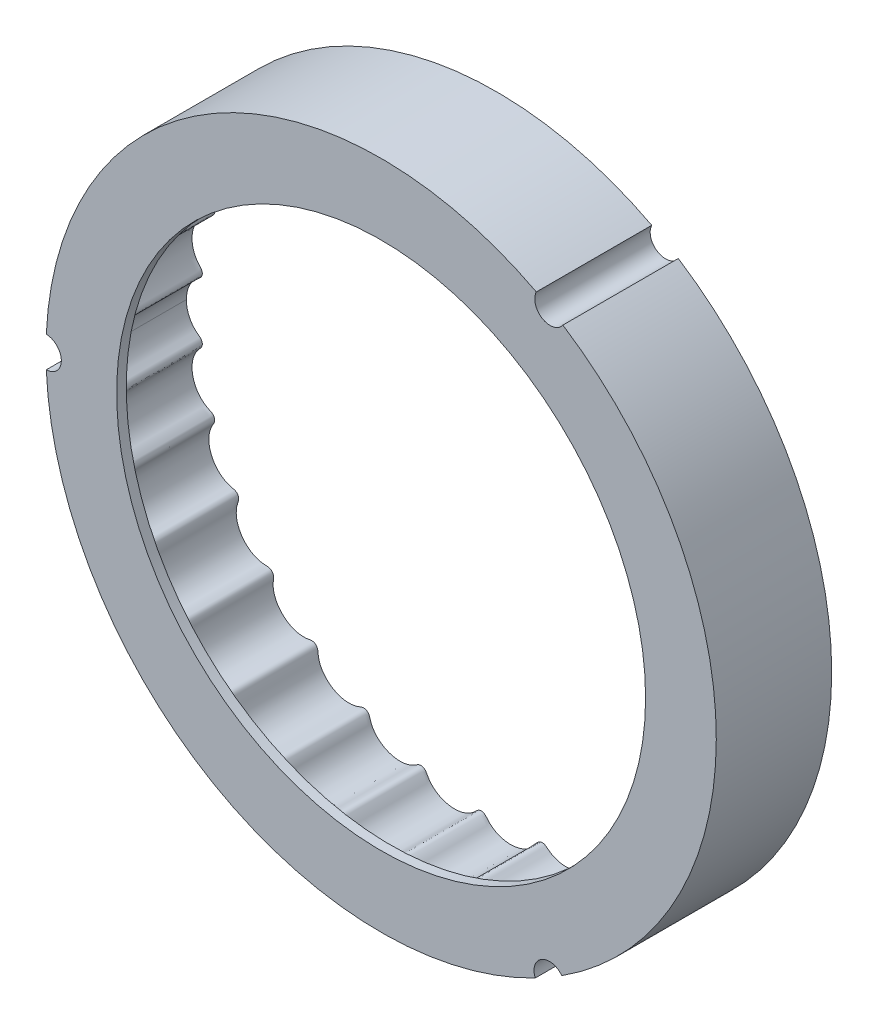
from build123d import *

# Parameters (mm, degrees)
ESQUISSE1_R             = 34.85
BOSS_EXTRU_1_DEPTH      = 11
ESQUISSE3_R             = 34.85
ESQUISSE3_R_2           = 27.5
BOSS_EXTRU_2_DEPTH      = 1
ESQUISSE4_R             = 1.6
ENL_V_MAT_EXTRU_2_DEPTH = 51.725191141


with BuildPart() as part:
    # Esquisse1 → Boss.-Extru.1 (new body)
    with BuildSketch(Plane.XY):
        Circle(ESQUISSE1_R)
        with BuildLine():
            add(Edge.make_bspline(
                [(30.75, 0), (30.75, -0.012466551), (30.750978291, -0.037435326), (30.755380523, -0.087337177), (30.767021407, -0.146605526), (30.784235638, -0.201639987), (30.806725403, -0.255918868), (30.840935147, -0.321123985), (30.887422434, -0.389111538), (30.947096406, -0.458089435), (31.018450958, -0.527969594), (31.087642774, -0.591592772), (31.173963904, -0.671262461), (31.275013947, -0.769628319), (31.418667793, -0.925049962), (31.590505656, -1.149287713), (31.765198528, -1.440584759), (31.922692534, -1.804453032), (32.034958648, -2.194853386), (32.098455422, -2.605847675), (32.110893976, -3.018484836), (32.074041221, -3.426596924), (31.989674774, -3.824502644), (31.859579575, -4.20675551), (31.685835108, -4.56634961), (31.470950798, -4.897742168), (31.24907067, -5.158368371), (31.037624658, -5.355859269), (30.846956876, -5.502834102), (30.686542549, -5.609708869), (30.511303765, -5.713032229), (30.327949226, -5.826454032), (30.173095555, -5.998578141), (30.093232003, -6.229100949), (30.110193836, -6.460044438), (30.200515583, -6.65648558), (30.319195295, -6.81880241), (30.429591873, -6.972377134), (30.556884573, -7.171669121), (30.686990471, -7.42432627), (30.81051827, -7.752064551), (30.902306801, -8.157965927), (30.939306602, -8.590969655), (30.91541063, -9.043225199), (30.833120238, -9.47917927), (30.698564824, -9.892214886), (30.517499761, -10.276882491), (30.295359778, -10.628695383), (30.03663758, -10.942013482), (29.746966061, -11.212937701), (29.470433337, -11.410145285), (29.223317503, -11.547196269), (29.007991406, -11.641437129), (28.831489277, -11.706780195), (28.642058234, -11.769172318), (28.450045732, -11.863081746), (28.288329456, -12.026987259), (28.210287752, -12.224918325), (28.20346133, -12.405406571), (28.236785614, -12.570096872), (28.293783104, -12.715821968), (28.367996779, -12.873214243), (28.441734352, -13.051374202), (28.519282743, -13.279422724), (28.585875989, -13.561168059), (28.625891413, -13.901400281), (28.620176022, -14.296757725), (28.564173119, -14.692691042), (28.458894502, -15.083143097), (28.307859188, -15.458096406), (28.113801834, -15.812569773), (27.879487833, -16.141681779), (27.607733235, -16.440542983), (27.304935504, -16.701120752), (26.975605605, -16.919348027), (26.668066278, -17.069716959), (26.395293942, -17.166332894), (26.161761798, -17.224796282), (25.972001086, -17.258905238), (25.77009755, -17.283912083), (25.556930978, -17.318589654), (25.348986278, -17.421268885), (25.189696924, -17.606062532), (25.120163479, -17.826984077), (25.130694209, -18.042573767), (25.176826858, -18.238110843), (25.216893076, -18.422953837), (25.254028667, -18.656404758), (25.272254044, -18.939939771), (25.254622928, -19.289611344), (25.176827173, -19.698288661), (25.038154347, -20.109986708), (24.836067152, -20.515105141), (24.583785661, -20.886782695), (24.287592504, -21.219855725), (23.953496641, -21.509650647), (23.587386146, -21.751686499), (23.210135668, -21.933657843), (22.873869304, -22.043643078), (22.591374487, -22.102148479), (22.325158766, -22.133594977), (22.101571409, -22.140706228), (21.878531137, -22.127472643), (21.64366765, -22.109610546), (21.438911553, -22.128790646), (21.235010271, -22.221372978), (21.072081402, -22.396691751), (20.993021331, -22.612875938), (20.985637564, -22.829397015), (20.992657275, -23.032781427), (20.989114789, -23.225634535), (20.969103016, -23.465571964), (20.917534051, -23.750425404), (20.818402107, -24.078217858), (20.655461136, -24.438354859), (20.446318236, -24.77898339), (20.131259913, -25.173976814), (19.681623457, -25.583288583), (19.159101878, -25.898679173), (18.590417327, -26.101603516), (18.101715984, -26.187940575), (17.759635951, -26.202985797), (17.470900281, -26.182588302), (17.23345446, -26.142771473), (17.045752759, -26.098427136), (16.850546694, -26.04105894), (16.639855437, -25.991807329), (16.410596194, -26.010096582), (16.197941083, -26.119984154), (16.054054554, -26.291655725), (15.981224755, -26.484264107), (15.946773384, -26.67216042), (15.913564985, -26.847713157), (15.871685839, -27.021430326), (15.818449071, -27.192101981), (15.738226672, -27.400602374), (15.563680399, -27.758482427), (15.294509879, -28.138551919), (14.917145191, -28.511493641), (14.463348217, -28.825916643), (14.067254883, -29.030313323), (13.644707988, -29.182609996), (13.202266996, -29.278018794), (12.769160471, -29.310447345), (12.354022164, -29.284747019), (12.010913039, -29.215435201), (11.740678008, -29.127800828), (11.523693584, -29.034133165), (11.354530851, -28.949519002), (11.177174481, -28.855377593), (10.972347739, -28.788140756), (10.740900032, -28.795902093), (10.520165877, -28.899715369), (10.365449548, -29.072753766), (10.276488974, -29.269813162), (10.202138665, -29.459209799), (10.122065567, -29.634640688), (10.007780433, -29.846547273), (9.846740686, -30.087038042), (9.624994499, -30.347917925), (9.257073915, -30.680872369), (8.748044271, -31.005547481), (8.178506642, -31.224841958), (7.579451288, -31.328982908), (7.074194818, -31.33558044), (6.676837151, -31.291826712), (6.292424803, -31.199581901), (5.972732278, -31.076737502), (5.716146602, -30.942666011), (5.514413234, -30.811214119), (5.359908708, -30.695731217), (5.203466143, -30.565531259), (5.026930794, -30.439720932), (4.806886962, -30.371834664), (4.568763859, -30.395570685), (4.371718028, -30.501884115), (4.232419886, -30.652981867), (4.127613713, -30.812483406), (4.027239219, -30.960328748), (3.919539933, -31.102873512), (3.802517078, -31.238030468), (3.645681729, -31.39708508), (3.342807108, -31.655393467), (2.850196764, -31.953463879), (2.236864317, -32.159554757), (1.57334615, -32.232200172), (1.015521856, -32.196526691), (0.571557429, -32.107674615), (0.161283705, -31.964658139), (-0.209217883, -31.775370602), (-0.496194196, -31.574729658), (-0.708889751, -31.386328198), (-0.870479972, -31.213757884), (-0.991906569, -31.068751011), (-1.118600595, -30.912755833), (-1.283802812, -30.77364241), (-1.50177773, -30.695368016), (-1.745288935, -30.710453884), (-1.952773559, -30.813794282), (-2.109935037, -30.9617471), (-2.253484059, -31.105903729), (-2.396791197, -31.234857562), (-2.586266177, -31.383358797), (-2.829905081, -31.53946165), (-3.137313102, -31.690050518), (-3.511638872, -31.816266932), (-3.903126981, -31.89558302), (-4.305796572, -31.92693373), (-4.709428249, -31.91017939), (-5.108431436, -31.846078498), (-5.497253612, -31.735420208), (-5.870273183, -31.579083817), (-6.217378252, -31.380436639), (-6.533152655, -31.142394658), (-6.777297144, -30.902023384), (-6.958914424, -30.676536915), (-7.091402356, -30.4753478), (-7.186885131, -30.30782225), (-7.265867953, -30.152740478), (-7.346855679, -30.018784595), (-7.457681197, -29.892404345), (-7.60553599, -29.788631328), (-7.810335103, -29.731112085), (-8.038593116, -29.760689184), (-8.229618994, -29.856257723), (-8.394816518, -29.9678965), (-8.554688939, -30.067243562), (-8.761219567, -30.179444188), (-9.021074936, -30.290468637), (-9.346448338, -30.387833531), (-9.738074935, -30.45039329), (-10.144176955, -30.462548242), (-10.558233153, -30.422238345), (-10.973080432, -30.329358), (-11.381841314, -30.182346239), (-11.776677722, -29.979979329), (-12.148584824, -29.721454636), (-12.467916496, -29.426609232), (-12.732187808, -29.105081948), (-12.915225976, -28.80641542), (-13.03487844, -28.548612507), (-13.114181552, -28.325794213), (-13.167788721, -28.144409516), (-13.22395419, -27.951277061), (-13.325570796, -27.760308071), (-13.499181016, -27.607119994), (-13.731038092, -27.531281103), (-13.961638649, -27.550325469), (-14.163155902, -27.626619217), (-14.352236725, -27.701671193), (-14.535020621, -27.762827079), (-14.768085048, -27.823174098), (-15.053755399, -27.868974691), (-15.395692291, -27.884288313), (-15.789188843, -27.850723971), (-16.278477536, -27.746331558), (-16.752840182, -27.560901205), (-17.194557572, -27.301468319), (-17.590716934, -26.97428386), (-17.87644948, -26.672015571), (-18.115919757, -26.343859054), (-18.306739131, -25.996227401), (-18.429482089, -25.679570016), (-18.501270208, -25.406255491), (-18.539399373, -25.174330622), (-18.558976893, -24.987108047), (-18.571760551, -24.78819228), (-18.61171465, -24.578519008), (-18.726239883, -24.378949606), (-18.895897533, -24.250627404), (-19.068047978, -24.195684752), (-19.235848336, -24.184165155), (-19.391500857, -24.201416651), (-19.562492555, -24.233940762), (-19.753354572, -24.26127601), (-19.993502931, -24.280111301), (-20.282978203, -24.275062722), (-20.62258955, -24.229742144), (-21.00431105, -24.126378447), (-21.374143581, -23.974062339), (-21.726452872, -23.775287984), (-22.052339004, -23.536012023), (-22.347665728, -23.260153139), (-22.608419903, -22.951625966), (-22.830585063, -22.614392221), (-23.008044532, -22.256577927), (-23.137966714, -21.883559883), (-23.207650802, -21.548434104), (-23.233868929, -21.260282098), (-23.232901154, -21.019548449), (-23.218935644, -20.827285344), (-23.19308791, -20.625499772), (-23.171395968, -20.410869823), (-23.21469466, -20.183284139), (-23.349964976, -19.980242783), (-23.544142607, -19.854031001), (-23.755029658, -19.806888177), (-23.955988469, -19.801799201), (-24.144986012, -19.794823888), (-24.380442174, -19.773074374), (-24.659723113, -19.720773466), (-25.102454644, -19.583748012), (-25.571923788, -19.333855047), (-26.003256706, -18.993006763), (-26.375870189, -18.571626824), (-26.625124857, -18.20215167), (-26.823075066, -17.806717527), (-26.966843844, -17.392192767), (-27.049756553, -16.981734052), (-27.073164572, -16.628783839), (-27.060044319, -16.340630955), (-27.030669176, -16.119187804), (-26.995774458, -15.943853854), (-26.949270457, -15.771357955), (-26.894033787, -15.601397958), (-26.831811628, -15.421030995), (-26.796169531, -15.21878135), (-26.830728435, -14.997622482), (-26.955806551, -14.793653857), (-27.143052722, -14.65948272), (-27.350369916, -14.595684207), (-27.549151744, -14.551819123), (-27.735133332, -14.500607364), (-27.96273584, -14.421993188), (-28.226061235, -14.301645035), (-28.519239284, -14.12455143), (-28.827934712, -13.877519508), (-29.106252012, -13.590487417), (-29.410945114, -13.187328958), (-29.648569421, -12.739752245), (-29.813457, -12.260672538), (-29.900219677, -11.763100346), (-29.920303758, -11.36407803), (-29.890631705, -10.970079215), (-29.820680989, -10.634943946), (-29.729600376, -10.360248477), (-29.632436108, -10.139979755), (-29.542989628, -9.969160834), (-29.438948985, -9.794318673), (-29.336710564, -9.603945127), (-29.292590558, -9.376156501), (-29.34341498, -9.137555324), (-29.477260018, -8.948550251), (-29.655010404, -8.826328968), (-29.837952398, -8.743428067), (-30.00852719, -8.661710233), (-30.215640088, -8.547820996), (-30.450678595, -8.388222873), (-30.715953105, -8.159786654), (-30.990944518, -7.847674225), (-31.231016889, -7.485674209), (-31.427032099, -7.077644595), (-31.565885953, -6.650463689), (-31.647333706, -6.212241917), (-31.671341992, -5.770595707), (-31.637967099, -5.332917719), (-31.550269505, -4.923309446), (-31.430833245, -4.590237023), (-31.303681047, -4.331264436), (-31.188262944, -4.139982886), (-31.086186829, -3.993222979), (-30.974688463, -3.853591969), (-30.856371815, -3.719709273), (-30.728634747, -3.577746879), (-30.619668631, -3.403178608), (-30.570027677, -3.184776013), (-30.611119827, -2.948973779), (-30.735347564, -2.755298657), (-30.902668511, -2.617892737), (-31.067663107, -2.498810148), (-31.217809804, -2.377731949), (-31.394966629, -2.21470965), (-31.588243327, -1.999182568), (-31.757029051, -1.761099309), (-31.899946191, -1.50432232), (-32.001745872, -1.278667082), (-32.072893478, -1.089795434), (-32.132225215, -0.897200595), (-32.179715684, -0.70082959), (-32.210893403, -0.527619645), (-32.230197764, -0.377050267), (-32.241336158, -0.25116251), (-32.247277005, -0.157631371), (-32.24950491, -0.064498225), (-32.25, -0.021409221), (-32.25, 0)],
                knots=[0.074164953, 0.074164953, 0.074164953, 0.074164953, 0.074164953, 0.07460362, 0.075042288, 0.075480956, 0.075919624, 0.076358291, 0.076796959, 0.077674294, 0.078376767, 0.07907924, 0.079781713, 0.080484186, 0.081889131, 0.083294077, 0.086103968, 0.088913859, 0.092014101, 0.095114343, 0.098214585, 0.101314828, 0.10432547, 0.107336113, 0.110346755, 0.113357398, 0.116234596, 0.119111795, 0.120550394, 0.121988994, 0.123427593, 0.124866193, 0.126640249, 0.128414306, 0.130187266, 0.131960225, 0.133373318, 0.13478641, 0.136199503, 0.137612595, 0.14043878, 0.143264965, 0.146639475, 0.150013985, 0.153388495, 0.156763005, 0.159864606, 0.162966207, 0.166067808, 0.169169409, 0.171979199, 0.17478899, 0.176193886, 0.177598781, 0.179003676, 0.180408572, 0.182166529, 0.183924486, 0.185705816, 0.186596481, 0.187487146, 0.188926547, 0.190365948, 0.191805349, 0.19324475, 0.196123553, 0.199002355, 0.202017429, 0.205032504, 0.208047579, 0.211062653, 0.214074396, 0.217086139, 0.220097882, 0.223109625, 0.225987087, 0.228864548, 0.230303278, 0.231742009, 0.23318074, 0.23461947, 0.23639559, 0.238171709, 0.239943897, 0.241716085, 0.243128759, 0.244541432, 0.245954105, 0.247366778, 0.250192125, 0.253017472, 0.256390807, 0.259764143, 0.263137479, 0.266510814, 0.269781576, 0.273052337, 0.276323099, 0.27959386, 0.282263597, 0.283598466, 0.284933335, 0.287603072, 0.288937941, 0.290272809, 0.291978349, 0.293683888, 0.295463294, 0.297242701, 0.298681812, 0.300120924, 0.301560035, 0.302999146, 0.305877369, 0.308755592, 0.311769369, 0.314783146, 0.317796922, 0.323823638, 0.329849516, 0.332862455, 0.335740475, 0.338618495, 0.340057505, 0.341496515, 0.342935526, 0.344374536, 0.346152362, 0.347930189, 0.349637201, 0.351344213, 0.352679183, 0.354014153, 0.355349122, 0.356684092, 0.358019062, 0.359354032, 0.362023971, 0.368567294, 0.371838956, 0.375110618, 0.378483109, 0.3818556, 0.385228091, 0.388600583, 0.391425519, 0.394250455, 0.395662923, 0.397075391, 0.398487859, 0.399900327, 0.401671575, 0.403442823, 0.40522, 0.406997176, 0.408436108, 0.409875039, 0.411313971, 0.412752903, 0.415630766, 0.418508629, 0.42152116, 0.427546223, 0.433572959, 0.436587163, 0.439601368, 0.442615573, 0.445493951, 0.44837233, 0.449811519, 0.451250708, 0.452689897, 0.454129086, 0.455909198, 0.457689309, 0.459393993, 0.461098678, 0.462433521, 0.463768363, 0.465103206, 0.466438049, 0.467772891, 0.469107734, 0.471777419, 0.47831802, 0.484858622, 0.488232362, 0.491606102, 0.494979843, 0.498353583, 0.50117918, 0.504004778, 0.505417576, 0.506830375, 0.508243174, 0.509655973, 0.511428503, 0.513201034, 0.514976523, 0.516752012, 0.518190677, 0.519629342, 0.521068008, 0.522506673, 0.525384003, 0.528261333, 0.531272698, 0.534284062, 0.537295427, 0.540306791, 0.543322305, 0.546337819, 0.549353334, 0.552368848, 0.555247889, 0.55812693, 0.559566451, 0.561005971, 0.562445492, 0.563885012, 0.564775961, 0.56566691, 0.567448808, 0.569205741, 0.570962674, 0.572367569, 0.573772465, 0.57517736, 0.576582255, 0.579392045, 0.582201836, 0.585302986, 0.588404136, 0.591505286, 0.594606436, 0.597981309, 0.601356181, 0.604731054, 0.608105927, 0.610932446, 0.613758965, 0.615172225, 0.616585485, 0.617998745, 0.619412004, 0.621185051, 0.622958098, 0.624731365, 0.626504633, 0.627943229, 0.629381826, 0.630820423, 0.63225902, 0.635136214, 0.638013408, 0.641023709, 0.64403401, 0.650054612, 0.653155309, 0.656256005, 0.659356702, 0.662457399, 0.665267223, 0.668077047, 0.669481959, 0.670886871, 0.672291783, 0.673696695, 0.675452531, 0.677208368, 0.678991564, 0.679883162, 0.68077476, 0.682214218, 0.683653677, 0.685093136, 0.686532595, 0.689411513, 0.69229043, 0.695306386, 0.698322342, 0.701338298, 0.704354253, 0.707365251, 0.710376248, 0.713387245, 0.716398242, 0.719275486, 0.722152729, 0.723591351, 0.725029973, 0.726468595, 0.727907217, 0.729682016, 0.731456816, 0.733229603, 0.735002391, 0.736415329, 0.737828268, 0.739241207, 0.740654145, 0.743480023, 0.7463059, 0.753054164, 0.756428296, 0.759802428, 0.763072262, 0.766342096, 0.76961193, 0.772881764, 0.77555143, 0.776886264, 0.778221097, 0.779555931, 0.780890764, 0.782225598, 0.783560431, 0.785264184, 0.786967936, 0.78874869, 0.790529443, 0.791968729, 0.793408015, 0.7948473, 0.796286586, 0.799165157, 0.802043728, 0.805058366, 0.808073004, 0.811087641, 0.817114411, 0.820126544, 0.823138676, 0.826150808, 0.829028446, 0.831906085, 0.833344904, 0.834783723, 0.836222542, 0.837661361, 0.839438045, 0.841214729, 0.842986489, 0.84475825, 0.846170813, 0.847583376, 0.848995939, 0.850408501, 0.853233627, 0.856058753, 0.859431672, 0.862804591, 0.86617751, 0.869550429, 0.872821645, 0.87609286, 0.879364076, 0.882635291, 0.885305113, 0.886640024, 0.887974936, 0.889309847, 0.890644758, 0.891979669, 0.89331458, 0.895020895, 0.896727211, 0.898505854, 0.900284498, 0.901723549, 0.903162601, 0.904601653, 0.906040705, 0.908918809, 0.911796913, 0.91330359, 0.914810268, 0.916316945, 0.917823622, 0.919330299, 0.920836976, 0.921590315, 0.922343654, 0.923096992, 0.923850331, 0.923850331, 0.923850331, 0.923850331, 0.923850331], degree=4))
            add(Edge.make_bspline(
                [(30.75, 0), (30.75, 0.012466551), (30.750978291, 0.037435326), (30.755380523, 0.087337177), (30.767021407, 0.146605526), (30.784235638, 0.201639987), (30.806725403, 0.255918868), (30.840935147, 0.321123985), (30.887422434, 0.389111538), (30.947096406, 0.458089435), (31.018450958, 0.527969594), (31.087642774, 0.591592772), (31.173963904, 0.671262461), (31.275013947, 0.769628319), (31.418667793, 0.925049962), (31.590505656, 1.149287713), (31.765198528, 1.440584759), (31.922692534, 1.804453032), (32.034958648, 2.194853386), (32.098455422, 2.605847675), (32.110893976, 3.018484836), (32.074041221, 3.426596924), (31.989674774, 3.824502644), (31.859579575, 4.20675551), (31.685835108, 4.566349611), (31.470950798, 4.897742168), (31.24907067, 5.158368371), (31.037624658, 5.355859269), (30.846956876, 5.502834102), (30.686542549, 5.609708869), (30.511303765, 5.713032229), (30.327949226, 5.826454032), (30.173095555, 5.998578141), (30.093232003, 6.229100949), (30.110193836, 6.460044438), (30.200515583, 6.65648558), (30.319195295, 6.81880241), (30.429591873, 6.972377134), (30.556884573, 7.171669121), (30.686990471, 7.42432627), (30.81051827, 7.752064551), (30.902306801, 8.157965927), (30.939306602, 8.590969655), (30.91541063, 9.043225199), (30.833120238, 9.47917927), (30.698564824, 9.892214886), (30.517499761, 10.276882491), (30.295359778, 10.628695384), (30.03663758, 10.942013482), (29.746966061, 11.212937701), (29.470433337, 11.410145285), (29.223317503, 11.547196269), (29.007991406, 11.641437129), (28.831489277, 11.706780195), (28.642058234, 11.769172318), (28.450045732, 11.863081747), (28.288329456, 12.026987259), (28.210287752, 12.224918325), (28.20346133, 12.405406571), (28.236785614, 12.570096872), (28.293783104, 12.715821968), (28.367996779, 12.873214243), (28.441734352, 13.051374202), (28.519282743, 13.279422724), (28.585875989, 13.561168059), (28.625891413, 13.901400281), (28.620176022, 14.296757725), (28.564173119, 14.692691042), (28.458894502, 15.083143097), (28.307859188, 15.458096406), (28.113801834, 15.812569773), (27.879487833, 16.141681779), (27.607733235, 16.440542983), (27.304935504, 16.701120752), (26.975605605, 16.919348027), (26.668066278, 17.069716959), (26.395293942, 17.166332894), (26.161761798, 17.224796282), (25.972001086, 17.258905238), (25.77009755, 17.283912083), (25.556930978, 17.318589654), (25.348986278, 17.421268885), (25.189696924, 17.606062532), (25.120163479, 17.826984077), (25.130694209, 18.042573767), (25.176826858, 18.238110843), (25.216893076, 18.422953837), (25.254028667, 18.656404758), (25.272254044, 18.939939771), (25.254622928, 19.289611344), (25.176827173, 19.698288661), (25.038154347, 20.109986708), (24.836067152, 20.515105141), (24.583785661, 20.886782695), (24.287592504, 21.219855725), (23.953496641, 21.509650647), (23.587386146, 21.751686499), (23.210135668, 21.933657843), (22.873869304, 22.043643078), (22.591374487, 22.102148479), (22.325158766, 22.133594977), (22.101571409, 22.140706228), (21.878531137, 22.127472643), (21.64366765, 22.109610546), (21.438911553, 22.128790646), (21.235010271, 22.221372978), (21.072081402, 22.396691751), (20.993021331, 22.612875938), (20.985637564, 22.829397015), (20.992657275, 23.032781427), (20.989114789, 23.225634535), (20.969103016, 23.465571964), (20.917534051, 23.750425404), (20.818402107, 24.078217858), (20.655461136, 24.438354859), (20.446318236, 24.77898339), (20.131259913, 25.173976814), (19.681623457, 25.583288583), (19.159101878, 25.898679173), (18.590417327, 26.101603516), (18.101715984, 26.187940575), (17.759635951, 26.202985797), (17.470900281, 26.182588302), (17.23345446, 26.142771473), (17.045752759, 26.098427136), (16.850546694, 26.04105894), (16.639855437, 25.991807329), (16.410596194, 26.010096582), (16.197941083, 26.119984154), (16.054054553, 26.291655725), (15.981224755, 26.484264107), (15.946773384, 26.67216042), (15.913564985, 26.847713157), (15.871685839, 27.021430326), (15.818449071, 27.192101981), (15.738226672, 27.400602374), (15.563680399, 27.758482427), (15.294509879, 28.138551919), (14.917145191, 28.511493641), (14.463348217, 28.825916643), (14.067254883, 29.030313323), (13.644707988, 29.182609996), (13.202266996, 29.278018794), (12.769160471, 29.310447345), (12.354022164, 29.284747019), (12.010913039, 29.215435201), (11.740678008, 29.127800828), (11.523693584, 29.034133165), (11.354530851, 28.949519002), (11.177174481, 28.855377593), (10.972347739, 28.788140756), (10.740900032, 28.795902093), (10.520165877, 28.899715369), (10.365449548, 29.072753766), (10.276488974, 29.269813162), (10.202138665, 29.459209799), (10.122065567, 29.634640688), (10.007780433, 29.846547273), (9.846740686, 30.087038042), (9.624994499, 30.347917925), (9.257073915, 30.680872369), (8.748044271, 31.005547481), (8.178506642, 31.224841958), (7.579451288, 31.328982908), (7.074194818, 31.33558044), (6.676837151, 31.291826712), (6.292424803, 31.199581901), (5.972732278, 31.076737502), (5.716146602, 30.942666011), (5.514413234, 30.811214119), (5.359908708, 30.695731217), (5.203466143, 30.565531259), (5.026930794, 30.439720932), (4.806886962, 30.371834664), (4.568763859, 30.395570685), (4.371718028, 30.501884115), (4.232419886, 30.652981867), (4.127613713, 30.812483406), (4.027239219, 30.960328748), (3.919539933, 31.102873512), (3.802517078, 31.238030468), (3.645681729, 31.39708508), (3.342807108, 31.655393467), (2.850196764, 31.953463879), (2.236864317, 32.159554757), (1.57334615, 32.232200172), (1.015521856, 32.196526691), (0.571557429, 32.107674615), (0.161283705, 31.964658139), (-0.209217883, 31.775370602), (-0.496194196, 31.574729658), (-0.708889751, 31.386328198), (-0.870479972, 31.213757884), (-0.991906569, 31.068751012), (-1.118600595, 30.912755833), (-1.283802812, 30.77364241), (-1.50177773, 30.695368016), (-1.745288935, 30.710453884), (-1.952773559, 30.813794282), (-2.109935037, 30.9617471), (-2.253484059, 31.105903729), (-2.396791197, 31.234857562), (-2.586266177, 31.383358797), (-2.829905082, 31.53946165), (-3.137313102, 31.690050518), (-3.511638872, 31.816266932), (-3.903126981, 31.89558302), (-4.305796572, 31.92693373), (-4.709428249, 31.91017939), (-5.108431436, 31.846078498), (-5.497253612, 31.735420208), (-5.870273183, 31.579083817), (-6.217378252, 31.380436639), (-6.533152655, 31.142394658), (-6.777297144, 30.902023384), (-6.958914424, 30.676536915), (-7.091402356, 30.4753478), (-7.186885131, 30.30782225), (-7.265867953, 30.152740478), (-7.346855679, 30.018784595), (-7.457681197, 29.892404345), (-7.60553599, 29.788631328), (-7.810335103, 29.731112085), (-8.038593116, 29.760689184), (-8.229618994, 29.856257723), (-8.394816518, 29.9678965), (-8.554688939, 30.067243562), (-8.761219567, 30.179444188), (-9.021074936, 30.290468637), (-9.346448338, 30.387833531), (-9.738074935, 30.45039329), (-10.144176955, 30.462548242), (-10.558233153, 30.422238345), (-10.973080432, 30.329358), (-11.381841314, 30.182346239), (-11.776677722, 29.979979329), (-12.148584824, 29.721454636), (-12.467916496, 29.426609232), (-12.732187808, 29.105081948), (-12.915225976, 28.80641542), (-13.03487844, 28.548612507), (-13.114181552, 28.325794213), (-13.167788721, 28.144409516), (-13.22395419, 27.951277061), (-13.325570796, 27.760308071), (-13.499181016, 27.607119994), (-13.731038092, 27.531281103), (-13.961638649, 27.550325469), (-14.163155902, 27.626619217), (-14.352236725, 27.701671193), (-14.535020621, 27.762827079), (-14.768085048, 27.823174098), (-15.053755399, 27.868974691), (-15.395692291, 27.884288313), (-15.789188843, 27.850723971), (-16.278477536, 27.746331558), (-16.752840182, 27.560901205), (-17.194557572, 27.301468319), (-17.590716934, 26.97428386), (-17.87644948, 26.672015571), (-18.115919757, 26.343859054), (-18.306739131, 25.996227401), (-18.429482089, 25.679570016), (-18.501270208, 25.406255491), (-18.539399373, 25.174330622), (-18.558976893, 24.987108047), (-18.571760551, 24.78819228), (-18.61171465, 24.578519008), (-18.726239883, 24.378949606), (-18.895897533, 24.250627404), (-19.068047978, 24.195684752), (-19.235848336, 24.184165155), (-19.391500857, 24.201416651), (-19.562492555, 24.233940762), (-19.753354572, 24.26127601), (-19.993502931, 24.280111301), (-20.282978203, 24.275062722), (-20.62258955, 24.229742144), (-21.00431105, 24.126378447), (-21.374143581, 23.974062339), (-21.726452872, 23.775287984), (-22.052339004, 23.536012023), (-22.347665728, 23.260153139), (-22.608419903, 22.951625966), (-22.830585063, 22.614392221), (-23.008044532, 22.256577927), (-23.137966714, 21.883559883), (-23.207650802, 21.548434104), (-23.233868929, 21.260282098), (-23.232901154, 21.019548449), (-23.218935644, 20.827285344), (-23.19308791, 20.625499772), (-23.171395968, 20.410869823), (-23.21469466, 20.183284139), (-23.349964976, 19.980242783), (-23.544142607, 19.854031001), (-23.755029658, 19.806888177), (-23.955988469, 19.801799201), (-24.144986012, 19.794823888), (-24.380442174, 19.773074374), (-24.659723113, 19.720773466), (-25.102454644, 19.583748012), (-25.571923788, 19.333855047), (-26.003256706, 18.993006763), (-26.375870189, 18.571626824), (-26.625124857, 18.20215167), (-26.823075066, 17.806717527), (-26.966843844, 17.392192767), (-27.049756553, 16.981734052), (-27.073164572, 16.628783839), (-27.060044319, 16.340630955), (-27.030669176, 16.119187804), (-26.995774458, 15.943853854), (-26.949270457, 15.771357955), (-26.894033787, 15.601397958), (-26.831811628, 15.421030995), (-26.796169531, 15.21878135), (-26.830728435, 14.997622482), (-26.955806551, 14.793653857), (-27.143052723, 14.65948272), (-27.350369916, 14.595684207), (-27.549151744, 14.551819123), (-27.735133332, 14.500607364), (-27.96273584, 14.421993188), (-28.226061235, 14.301645035), (-28.519239284, 14.12455143), (-28.827934712, 13.877519508), (-29.106252012, 13.590487417), (-29.410945114, 13.187328958), (-29.648569421, 12.739752245), (-29.813457, 12.260672538), (-29.900219677, 11.763100346), (-29.920303758, 11.36407803), (-29.890631705, 10.970079215), (-29.820680989, 10.634943946), (-29.729600376, 10.360248477), (-29.632436108, 10.139979755), (-29.542989628, 9.969160834), (-29.438948985, 9.794318673), (-29.336710564, 9.603945127), (-29.292590558, 9.376156501), (-29.34341498, 9.137555324), (-29.477260018, 8.948550251), (-29.655010404, 8.826328968), (-29.837952398, 8.743428067), (-30.00852719, 8.661710233), (-30.215640088, 8.547820996), (-30.450678595, 8.388222873), (-30.715953105, 8.159786654), (-30.990944518, 7.847674225), (-31.231016889, 7.485674209), (-31.427032099, 7.077644595), (-31.565885953, 6.650463689), (-31.647333706, 6.212241917), (-31.671341992, 5.770595707), (-31.637967099, 5.332917719), (-31.550269505, 4.923309446), (-31.430833245, 4.590237023), (-31.303681047, 4.331264436), (-31.188262944, 4.139982886), (-31.086186829, 3.993222979), (-30.974688463, 3.853591969), (-30.856371815, 3.719709273), (-30.728634747, 3.577746879), (-30.619668631, 3.403178608), (-30.570027677, 3.184776013), (-30.611119827, 2.948973779), (-30.735347564, 2.755298657), (-30.902668511, 2.617892737), (-31.067663107, 2.498810148), (-31.217809804, 2.377731949), (-31.394966629, 2.21470965), (-31.588243327, 1.999182568), (-31.757029051, 1.761099309), (-31.899946191, 1.50432232), (-32.001745872, 1.278667082), (-32.072893478, 1.089795434), (-32.132225215, 0.897200595), (-32.179715684, 0.70082959), (-32.210893403, 0.527619645), (-32.230197764, 0.377050267), (-32.241336158, 0.25116251), (-32.247277005, 0.157631371), (-32.24950491, 0.064498225), (-32.25, 0.021409221), (-32.25, 0)],
                knots=[0.074164953, 0.074164953, 0.074164953, 0.074164953, 0.074164953, 0.07460362, 0.075042288, 0.075480956, 0.075919624, 0.076358291, 0.076796959, 0.077674294, 0.078376767, 0.07907924, 0.079781713, 0.080484186, 0.081889131, 0.083294077, 0.086103968, 0.088913859, 0.092014101, 0.095114343, 0.098214585, 0.101314828, 0.10432547, 0.107336113, 0.110346755, 0.113357398, 0.116234596, 0.119111795, 0.120550394, 0.121988994, 0.123427593, 0.124866193, 0.126640249, 0.128414306, 0.130187266, 0.131960225, 0.133373318, 0.13478641, 0.136199503, 0.137612595, 0.14043878, 0.143264965, 0.146639475, 0.150013985, 0.153388495, 0.156763005, 0.159864606, 0.162966207, 0.166067808, 0.169169409, 0.171979199, 0.17478899, 0.176193886, 0.177598781, 0.179003676, 0.180408572, 0.182166529, 0.183924486, 0.185705816, 0.186596481, 0.187487146, 0.188926547, 0.190365948, 0.191805349, 0.19324475, 0.196123553, 0.199002355, 0.202017429, 0.205032504, 0.208047579, 0.211062653, 0.214074396, 0.217086139, 0.220097882, 0.223109625, 0.225987087, 0.228864548, 0.230303278, 0.231742009, 0.23318074, 0.23461947, 0.23639559, 0.238171709, 0.239943897, 0.241716085, 0.243128759, 0.244541432, 0.245954105, 0.247366778, 0.250192125, 0.253017472, 0.256390807, 0.259764143, 0.263137479, 0.266510814, 0.269781576, 0.273052337, 0.276323099, 0.27959386, 0.282263597, 0.283598466, 0.284933335, 0.287603072, 0.288937941, 0.290272809, 0.291978349, 0.293683888, 0.295463294, 0.297242701, 0.298681812, 0.300120924, 0.301560035, 0.302999146, 0.305877369, 0.308755592, 0.311769369, 0.314783146, 0.317796922, 0.323823638, 0.329849516, 0.332862455, 0.335740475, 0.338618495, 0.340057505, 0.341496515, 0.342935526, 0.344374536, 0.346152362, 0.347930189, 0.349637201, 0.351344213, 0.352679183, 0.354014153, 0.355349122, 0.356684092, 0.358019062, 0.359354032, 0.362023971, 0.368567294, 0.371838956, 0.375110618, 0.378483109, 0.3818556, 0.385228091, 0.388600583, 0.391425519, 0.394250455, 0.395662923, 0.397075391, 0.398487859, 0.399900327, 0.401671575, 0.403442823, 0.40522, 0.406997176, 0.408436108, 0.409875039, 0.411313971, 0.412752903, 0.415630766, 0.418508629, 0.42152116, 0.427546223, 0.433572959, 0.436587163, 0.439601368, 0.442615573, 0.445493951, 0.44837233, 0.449811519, 0.451250708, 0.452689897, 0.454129086, 0.455909198, 0.457689309, 0.459393993, 0.461098678, 0.462433521, 0.463768363, 0.465103206, 0.466438049, 0.467772891, 0.469107734, 0.471777419, 0.47831802, 0.484858622, 0.488232362, 0.491606102, 0.494979843, 0.498353583, 0.50117918, 0.504004778, 0.505417576, 0.506830375, 0.508243174, 0.509655973, 0.511428503, 0.513201034, 0.514976523, 0.516752012, 0.518190677, 0.519629342, 0.521068008, 0.522506673, 0.525384003, 0.528261333, 0.531272698, 0.534284062, 0.537295427, 0.540306791, 0.543322305, 0.546337819, 0.549353334, 0.552368848, 0.555247889, 0.55812693, 0.559566451, 0.561005971, 0.562445492, 0.563885012, 0.564775961, 0.56566691, 0.567448808, 0.569205741, 0.570962674, 0.572367569, 0.573772465, 0.57517736, 0.576582255, 0.579392045, 0.582201836, 0.585302986, 0.588404136, 0.591505286, 0.594606436, 0.597981309, 0.601356181, 0.604731054, 0.608105927, 0.610932446, 0.613758965, 0.615172225, 0.616585485, 0.617998745, 0.619412004, 0.621185051, 0.622958098, 0.624731365, 0.626504633, 0.627943229, 0.629381826, 0.630820423, 0.63225902, 0.635136214, 0.638013408, 0.641023709, 0.64403401, 0.650054612, 0.653155309, 0.656256005, 0.659356702, 0.662457399, 0.665267223, 0.668077047, 0.669481959, 0.670886871, 0.672291783, 0.673696695, 0.675452531, 0.677208368, 0.678991564, 0.679883162, 0.68077476, 0.682214218, 0.683653677, 0.685093136, 0.686532595, 0.689411513, 0.69229043, 0.695306386, 0.698322342, 0.701338298, 0.704354253, 0.707365251, 0.710376248, 0.713387245, 0.716398242, 0.719275486, 0.722152729, 0.723591351, 0.725029973, 0.726468595, 0.727907217, 0.729682016, 0.731456816, 0.733229603, 0.735002391, 0.736415329, 0.737828268, 0.739241207, 0.740654145, 0.743480023, 0.7463059, 0.753054164, 0.756428296, 0.759802428, 0.763072262, 0.766342096, 0.76961193, 0.772881764, 0.77555143, 0.776886264, 0.778221097, 0.779555931, 0.780890764, 0.782225598, 0.783560431, 0.785264184, 0.786967936, 0.78874869, 0.790529443, 0.791968729, 0.793408015, 0.7948473, 0.796286586, 0.799165157, 0.802043728, 0.805058366, 0.808073004, 0.811087641, 0.817114411, 0.820126544, 0.823138676, 0.826150808, 0.829028446, 0.831906085, 0.833344904, 0.834783723, 0.836222542, 0.837661361, 0.839438045, 0.841214729, 0.842986489, 0.84475825, 0.846170813, 0.847583376, 0.848995939, 0.850408501, 0.853233627, 0.856058753, 0.859431672, 0.862804591, 0.86617751, 0.869550429, 0.872821645, 0.87609286, 0.879364076, 0.882635291, 0.885305113, 0.886640024, 0.887974936, 0.889309847, 0.890644758, 0.891979669, 0.89331458, 0.895020895, 0.896727211, 0.898505854, 0.900284498, 0.901723549, 0.903162601, 0.904601653, 0.906040705, 0.908918809, 0.911796913, 0.91330359, 0.914810268, 0.916316945, 0.917823622, 0.919330299, 0.920836976, 0.921590315, 0.922343654, 0.923096992, 0.923850331, 0.923850331, 0.923850331, 0.923850331, 0.923850331], degree=4))
        make_face(mode=Mode.SUBTRACT)
    extrude(amount=BOSS_EXTRU_1_DEPTH)

    # Esquisse3 → Boss.-Extru.2 (add)
    with BuildSketch(Plane.XY.offset(11)):
        Circle(ESQUISSE3_R)
        Circle(ESQUISSE3_R_2, mode=Mode.SUBTRACT)
    extrude(amount=BOSS_EXTRU_2_DEPTH)

    # Esquisse4 → Enlèv. mat.-Extru.2 (cut, through all)
    with BuildSketch(Plane.XY.offset(12)):
        with Locations((-34.85, 0)):
            Circle(ESQUISSE4_R)
        with Locations((17.575, 30.180985322)):
            Circle(ESQUISSE4_R)
        with Locations((17.5, -30.310889132)):
            Circle(ESQUISSE4_R)
    extrude(amount=-ENL_V_MAT_EXTRU_2_DEPTH, mode=Mode.SUBTRACT)


solid = part.part
